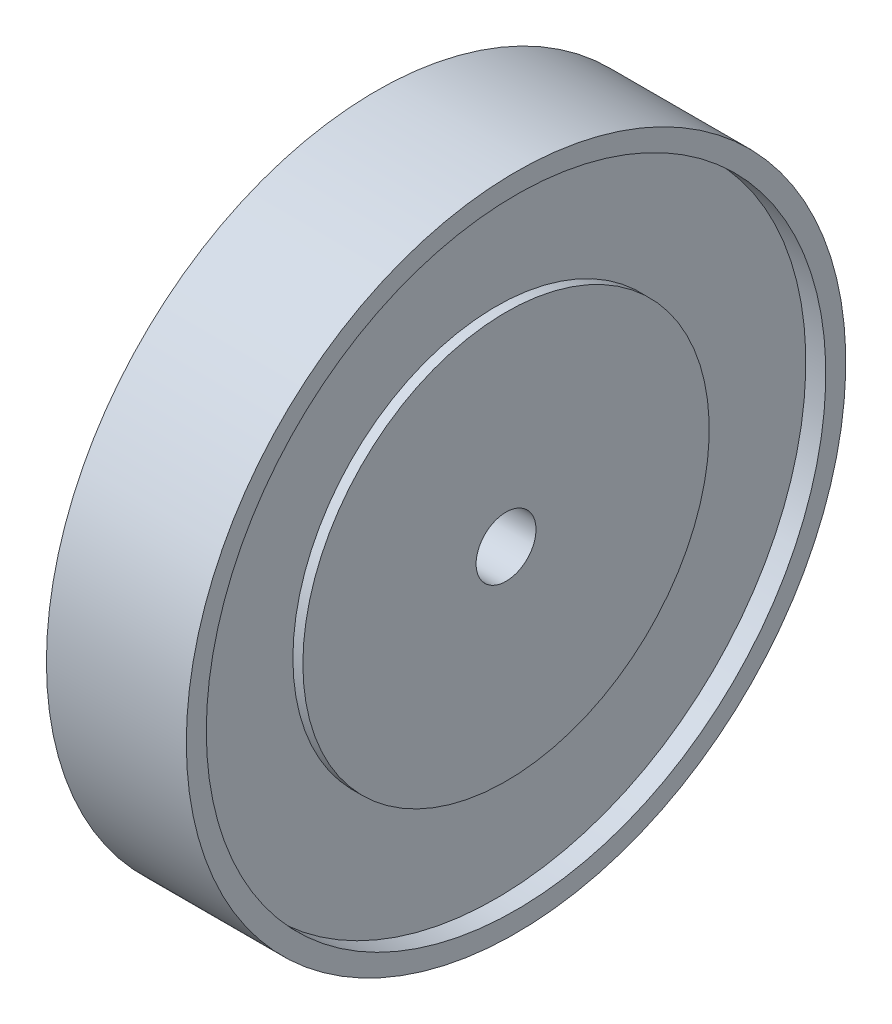
from build123d import *


with BuildPart() as part:
    # Sketch3 → Revolve1 (revolve)
    with BuildSketch(Plane.XY, mode=Mode.PRIVATE) as revolve1_sk:
        Polygon((-25, 15), (0, 15), (0, 165), (-35, 165), (-35, 155), (-25, 155), (-25, 101.665831819), (-30, 101.665831819), (-30, 15), align=None)
        Polygon((0, 165), (0, 15), (25, 15), (30, 15), (30, 101.665831819), (25, 101.665831819), (25, 155), (35, 155), (35, 165), align=None)
    revolve(revolve1_sk.sketch.rotate(Axis((0, 0, 0), (1, 0, 0)), 90), axis=Axis((0, 0, 0), (1, 0, 0)))


solid = part.part
